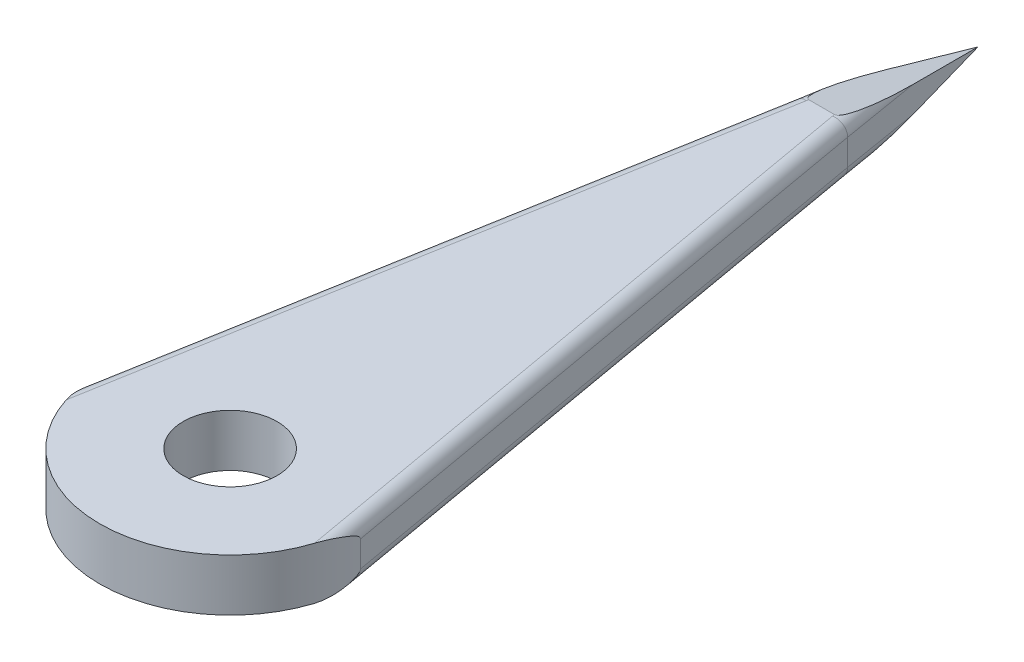
from build123d import *

# Parameters (mm, degrees)
SKETCH1_R           = 9
BOSS_EXTRUDE1_DEPTH = 10
FILLET11_R          = 2.5


with BuildPart() as part:
    # Sketch1 → Boss-Extrude1 (new body)
    with BuildSketch(Plane(origin=(0, 0, 0), x_dir=(1, 0, 0), z_dir=(0, 1, 0))):
        with BuildLine():
            Line((25, 0), (5, 113.425636392))
            Line((5, 113.425636392), (-5, 113.425636392))
            Line((-5, 113.425636392), (-25, 0))
            ThreePointArc((-25, 0), (0, -25), (25, 0))
        make_face()
        with Locations(Location((0, 0, 0), (0, 0, 270))):
            Circle(SKETCH1_R, mode=Mode.SUBTRACT)
    extrude(amount=BOSS_EXTRUDE1_DEPTH)

    # Sketch4 → Loft2 section 0
    with BuildSketch(Plane(origin=(0, 0, -113.425636392), x_dir=(-1, 0, 0), z_dir=(0, 0, -1)), mode=Mode.PRIVATE) as loft2_s0:
        with BuildLine():
            Line((-5, 10), (5, 10))
            Line((5, 10), (5, 0))
            Line((5, 0), (-5, 0))
            Line((-5, 0), (-5, 10))
        make_face()
    loft([loft2_s0.sketch, Vertex(0, 5, -143.425636392)])

    # Fillet11
    fillet11_edges = [part.edges().sort_by_distance(p)[0] for p in [
        (15, 0, -56.712818196),
        (15, 10, -56.712818196),
        (-15, 0, -56.712818196),
        (-15, 10, -56.712818196),
    ]]
    fillet(fillet11_edges, radius=FILLET11_R)


solid = part.part
